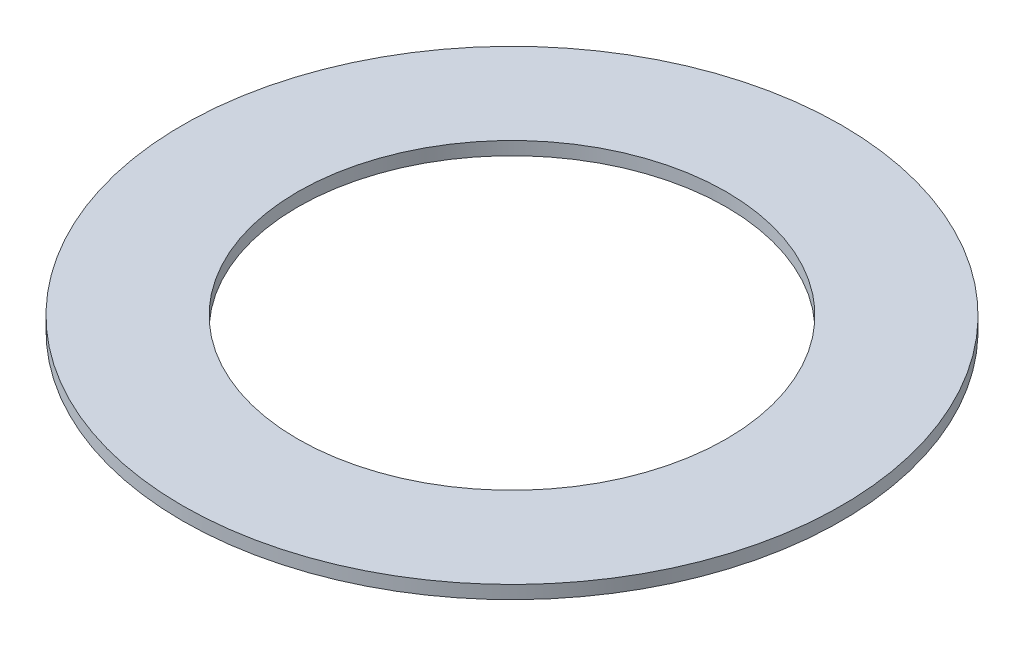
from build123d import *

# Parameters (mm, degrees)
SKETCH1_R           = 10
SKETCH1_R_2         = 6.5
BOSS_EXTRUDE1_DEPTH = 0.4


with BuildPart() as part:
    # Sketch1 → Boss-Extrude1 (new body)
    with BuildSketch(Plane(origin=(0, 0, 0), x_dir=(1, 0, 0), z_dir=(0, 1, 0))):
        with Locations(Location((0, 0, 0), (0, 0, 270))):
            Circle(SKETCH1_R)
        with Locations(Location((0, 0, 0), (0, 0, 270))):
            Circle(SKETCH1_R_2, mode=Mode.SUBTRACT)
    extrude(amount=BOSS_EXTRUDE1_DEPTH)


solid = part.part
